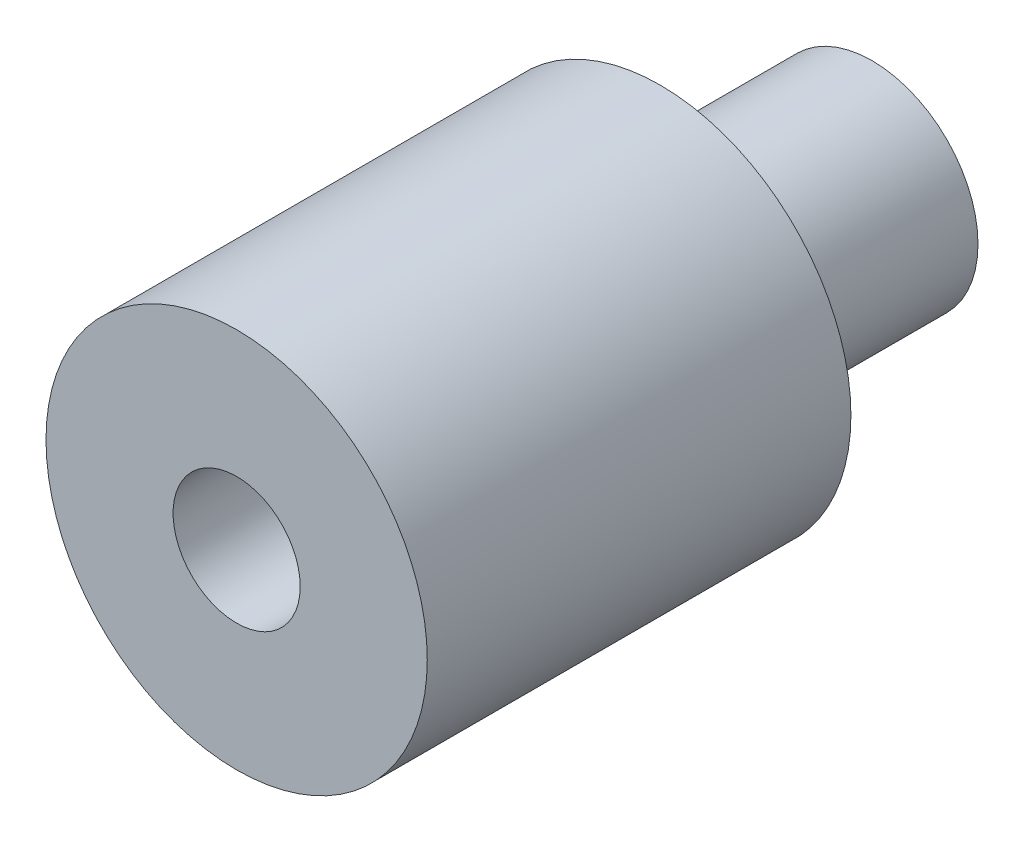
from build123d import *

# Parameters (mm, degrees)
SKETCH1_R           = 2.5
BOSS_EXTRUDE1_DEPTH = 5
SKETCH2_R           = 4.5
BOSS_EXTRUDE2_DEPTH = 10
SKETCH3_R           = 1.5
CUT_EXTRUDE1_DEPTH  = 8


with BuildPart() as part:
    # Sketch1 → Boss-Extrude1 (new body)
    with BuildSketch(Plane.XY):
        Circle(SKETCH1_R)
    extrude(amount=BOSS_EXTRUDE1_DEPTH)

    # Sketch2 → Boss-Extrude2 (add)
    with BuildSketch(Plane.XY.offset(5)):
        Circle(SKETCH2_R)
    extrude(amount=BOSS_EXTRUDE2_DEPTH)

    # Sketch3 → Cut-Extrude1 (cut)
    with BuildSketch(Plane.XY.offset(15)):
        Circle(SKETCH3_R)
    extrude(amount=-CUT_EXTRUDE1_DEPTH, mode=Mode.SUBTRACT)


solid = part.part
